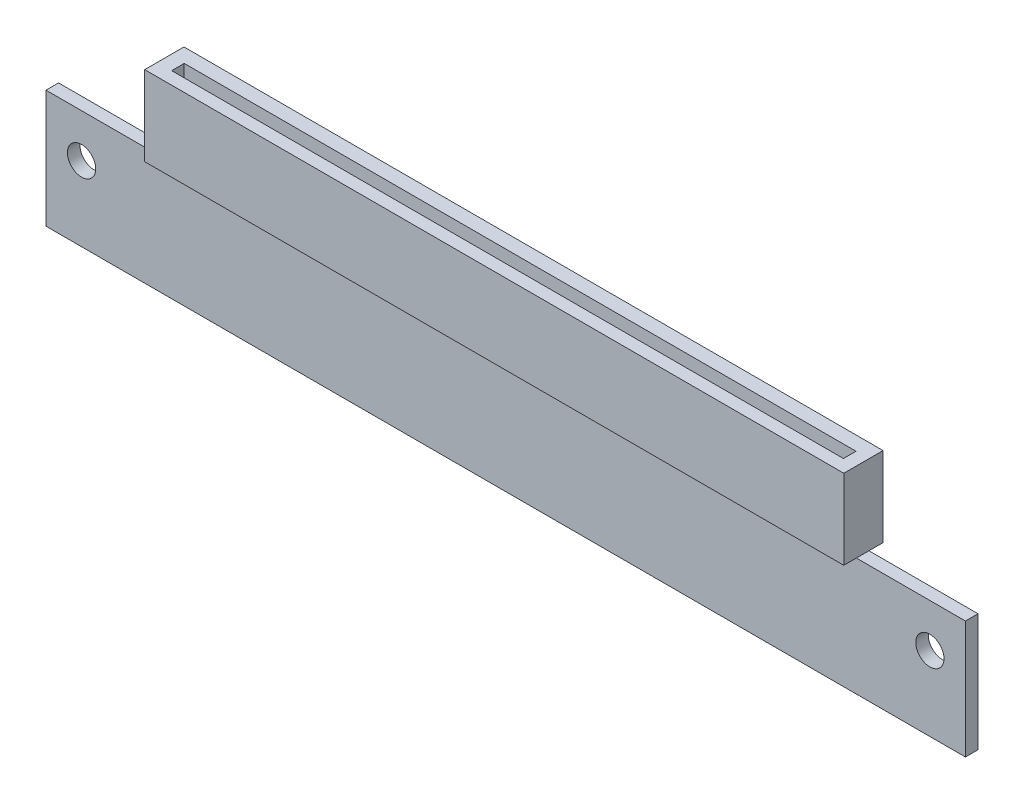
from build123d import *

# Parameters (mm, degrees)
SKETCH1_W            = 89
SKETCH1_H            = 5
BOSS_EXTRUDE1_DEPTH  = 10.14943
SKETCH2_W            = 85.527
SKETCH2_H            = 1.6
CUT_EXTRUDE1_DEPTH   = 7.7558
SKETCH3_W            = 117.05158
SKETCH3_H            = 1.6
BOSS_EXTRUDE2_DEPTH  = 15
M3_CLEARANCE_HOLE1_D = 3.6


with BuildPart() as part:
    # Sketch1 → Boss-Extrude1 (new body)
    with BuildSketch(Plane(origin=(0, 0, 0), x_dir=(1, 0, 0), z_dir=(0, 1, 0))):
        Rectangle(SKETCH1_W, SKETCH1_H)
    extrude(amount=BOSS_EXTRUDE1_DEPTH)

    # Sketch2 → Cut-Extrude1 (cut)
    with BuildSketch(Plane(origin=(0, 10.14943, 0), x_dir=(1, 0, 0), z_dir=(0, 1, 0))):
        with Locations((0.0912, -0.097552871)):
            Rectangle(SKETCH2_W, SKETCH2_H)
    extrude(amount=-CUT_EXTRUDE1_DEPTH, mode=Mode.SUBTRACT)

    # Sketch3 → Boss-Extrude2 (add)
    with BuildSketch(Plane.XZ):
        with Locations((-0.14221, 0.097552871)):
            Rectangle(SKETCH3_W, SKETCH3_H)
    extrude(amount=BOSS_EXTRUDE2_DEPTH)

    # M3 Clearance Hole1 (through all)
    with Locations(Plane.XY.offset(0.897552871)):
        with Locations((-54.14221, -5.5258), (53.85779, -5.5258)):
            Hole(M3_CLEARANCE_HOLE1_D / 2)


solid = part.part
